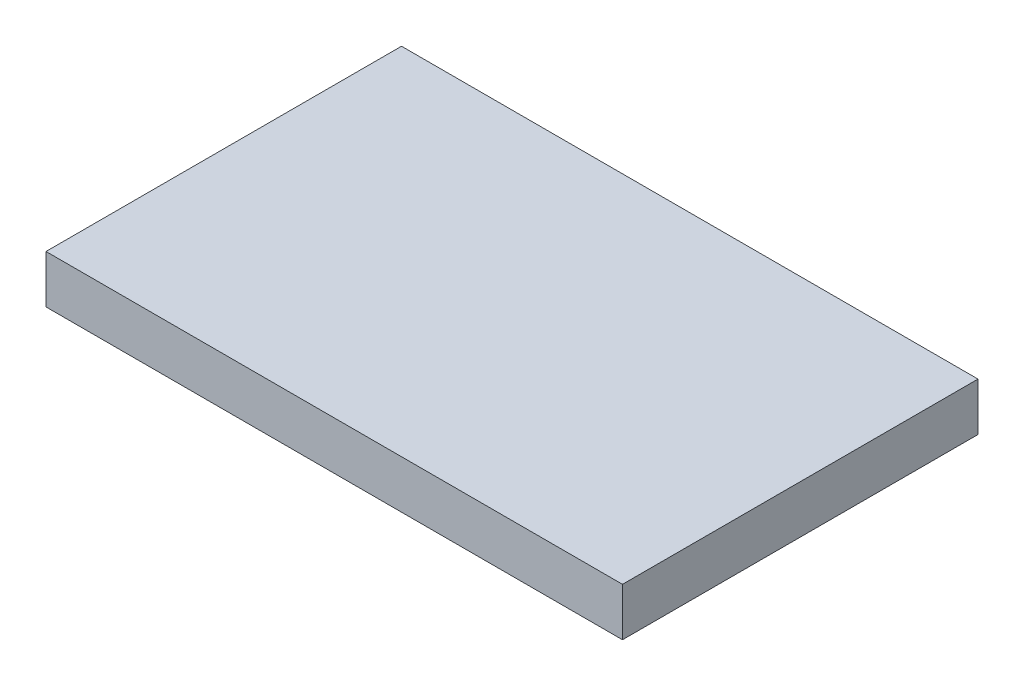
from build123d import *

# Parameters (mm, degrees)
ESQUISSE1_W        = 60
ESQUISSE1_H        = 37
BOSS_EXTRU_1_DEPTH = 5


with BuildPart() as part:
    # Esquisse1 → Boss.-Extru.1 (new body)
    with BuildSketch(Plane(origin=(0, 0, 0), x_dir=(1, 0, 0), z_dir=(0, 1, 0))):
        Rectangle(ESQUISSE1_W, ESQUISSE1_H)
    extrude(amount=BOSS_EXTRU_1_DEPTH)


solid = part.part
